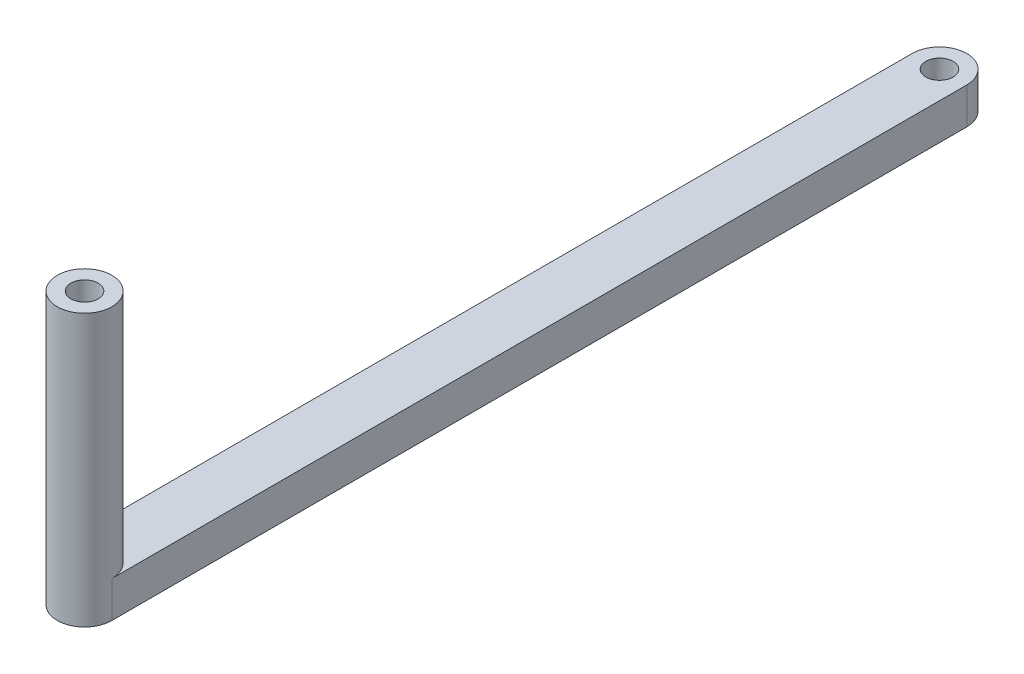
from build123d import *

# Parameters (mm, degrees)
SKETCH1_R           = 0.75
BOSS_EXTRUDE2_DEPTH = 2
SKETCH2_R           = 1.5
SKETCH2_R_2         = 0.75
BOSS_EXTRUDE3_DEPTH = 12.94


with BuildPart() as part:
    # Sketch1 → Boss-Extrude2 (new body)
    with BuildSketch(Plane(origin=(0, 0, 0), x_dir=(1, 0, 0), z_dir=(0, 1, 0))):
        with BuildLine():
            Line((0, 0), (0, 47))
            ThreePointArc((0, 47), (1.5, 48.5), (3, 47))
            Line((3, 47), (3, 0))
            ThreePointArc((3, 0), (1.5, -1.5), (0, 0))
        make_face()
        with Locations(Location((1.5, 0, 0), (0, 0, 270))):
            Circle(SKETCH1_R, mode=Mode.SUBTRACT)
        with Locations(Location((1.5, 47, 0), (0, 0, 270))):
            Circle(SKETCH1_R, mode=Mode.SUBTRACT)
    extrude(amount=BOSS_EXTRUDE2_DEPTH)

    # Sketch2 → Boss-Extrude3 (add)
    with BuildSketch(Plane(origin=(0, 2, 0), x_dir=(1, 0, 0), z_dir=(0, 1, 0))):
        with Locations((1.5, 0)):
            Circle(SKETCH2_R)
        with Locations(Location((1.5, 0, 0), (0, 0, 270))):
            Circle(SKETCH2_R_2, mode=Mode.SUBTRACT)
    extrude(amount=BOSS_EXTRUDE3_DEPTH)


solid = part.part
